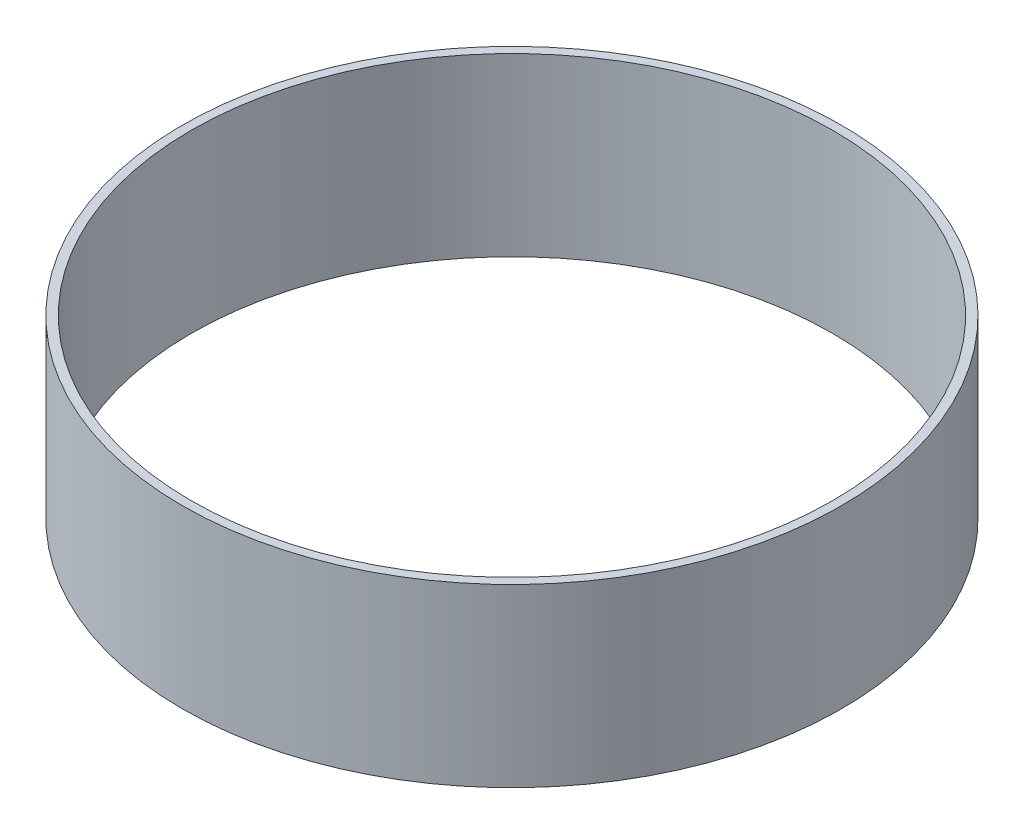
from build123d import *

# Parameters (mm, degrees)
SKETCH1_W = 3.81
SKETCH1_H = 76.2


with BuildPart() as part:
    # Sketch1 → Revolve1 (revolve)
    with BuildSketch(Plane.XY, mode=Mode.PRIVATE) as revolve1_sk:
        with Locations((140.81125, 154.851652174)):
            Rectangle(SKETCH1_W, SKETCH1_H)
    revolve(revolve1_sk.sketch.rotate(Axis((0, 0, 0), (0, -1, 0)), 90), axis=Axis((0, 0, 0), (0, -1, 0)))


solid = part.part
